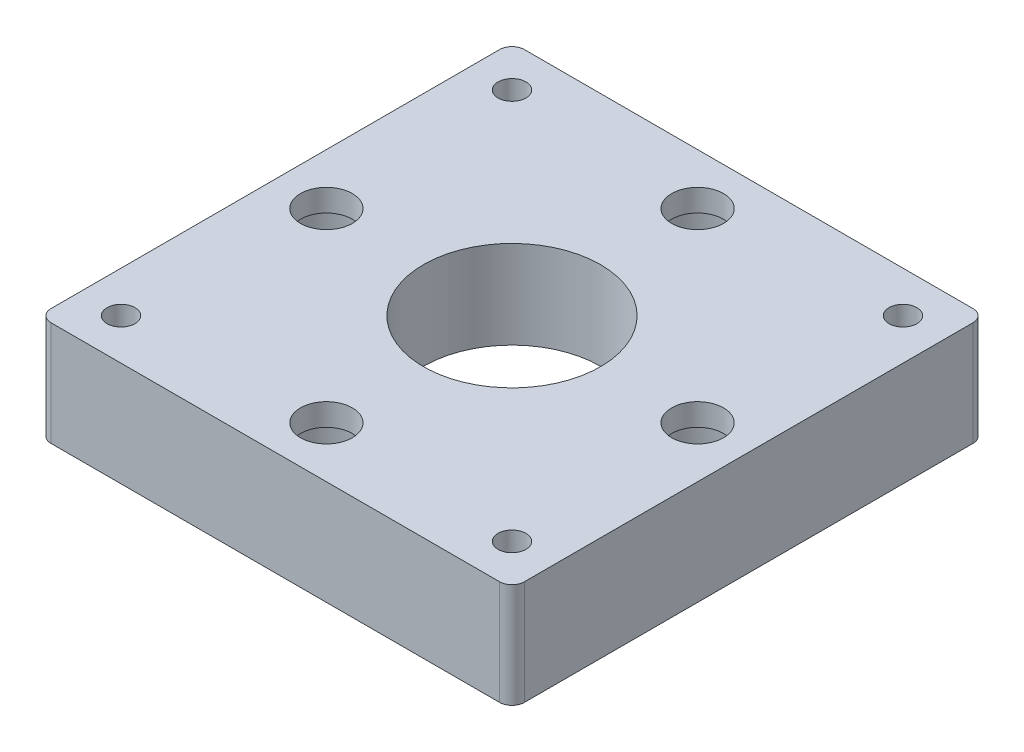
from build123d import *

# Parameters (mm, degrees)
SALIENTE_EXTRUIR1_DEPTH = 12.7
CROQUIS1_4_OUTSIDE_W    = 75.96
CROQUIS1_4_OUTSIDE_H    = 75.96
CROQUIS1_4_OUTSIDE_R    = 1.693796282
CORTAR_EXTRUIR1_DEPTH   = 29.7
CROQUIS2_R              = 19
CORTAR_EXTRUIR2_DEPTH   = 2
CROQUIS3_R              = 10.75
CORTAR_EXTRUIR3_DEPTH   = 43.043013688
CROQUIS4_R              = 5.5
CORTAR_EXTRUIR4_DEPTH   = 10
CROQUIS6_R              = 3.15
CORTAR_EXTRUIR5_DEPTH   = 42.870335561


with BuildPart() as part:
    # Croquis1 → Saliente-Extruir1 (new body)
    with BuildSketch(Plane(origin=(0, 0, 0), x_dir=(1, 0, 0), z_dir=(0, 1, 0))):
        with BuildLine():
            Line((-27.25, -28.75), (27.25, -28.75))
            ThreePointArc((27.25, -28.75), (28.310660172, -28.310660172), (28.75, -27.25))
            Line((28.75, -27.25), (28.75, 27.25))
            ThreePointArc((28.75, 27.25), (28.310660172, 28.310660172), (27.25, 28.75))
            Line((27.25, 28.75), (-27.25, 28.75))
            ThreePointArc((-27.25, 28.75), (-28.310660172, 28.310660172), (-28.75, 27.25))
            Line((-28.75, 27.25), (-28.75, -27.25))
            ThreePointArc((-28.75, -27.25), (-28.310660172, -28.310660172), (-27.25, -28.75))
        make_face()
    extrude(amount=SALIENTE_EXTRUIR1_DEPTH)

    # Croquis1<4> outside → Cortar-Extruir1 (cut)
    # profile 1 of 5: a face of its own
    with BuildSketch(Plane(origin=(0, 0, 0), x_dir=(1, 0, 0), z_dir=(0, 1, 0))):
        Rectangle(CROQUIS1_4_OUTSIDE_W, CROQUIS1_4_OUTSIDE_H)
        with BuildLine():
            Line((-27.25, -28.75), (27.25, -28.75))
            ThreePointArc((27.25, -28.75), (28.310660172, -28.310660172), (28.75, -27.25))
            Line((28.75, -27.25), (28.75, 27.25))
            ThreePointArc((28.75, 27.25), (28.310660172, 28.310660172), (27.25, 28.75))
            Line((27.25, 28.75), (-27.25, 28.75))
            ThreePointArc((-27.25, 28.75), (-28.310660172, 28.310660172), (-28.75, 27.25))
            Line((-28.75, 27.25), (-28.75, -27.25))
            ThreePointArc((-28.75, -27.25), (-28.310660172, -28.310660172), (-27.25, -28.75))
        make_face(mode=Mode.SUBTRACT)
    # profile 2 of 5: a face of its own
    with BuildSketch(Plane(origin=(0, 0, 0), x_dir=(1, 0, 0), z_dir=(0, 1, 0))):
        with Locations((-23.75, 23.75)):
            Circle(CROQUIS1_4_OUTSIDE_R)
    # profile 3 of 5: a face of its own
    with BuildSketch(Plane(origin=(0, 0, 0), x_dir=(1, 0, 0), z_dir=(0, 1, 0))):
        with Locations((23.75, 23.75)):
            Circle(CROQUIS1_4_OUTSIDE_R)
    # profile 4 of 5: a face of its own
    with BuildSketch(Plane(origin=(0, 0, 0), x_dir=(1, 0, 0), z_dir=(0, 1, 0))):
        with Locations((23.75, -23.75)):
            Circle(CROQUIS1_4_OUTSIDE_R)
    # profile 5 of 5: a face of its own
    with BuildSketch(Plane(origin=(0, 0, 0), x_dir=(1, 0, 0), z_dir=(0, 1, 0))):
        with Locations((-23.75, -23.75)):
            Circle(CROQUIS1_4_OUTSIDE_R)
    extrude(amount=CORTAR_EXTRUIR1_DEPTH, mode=Mode.SUBTRACT)

    # Croquis2 → Cortar-Extruir2 (cut)
    with BuildSketch(Plane.XZ):
        Circle(CROQUIS2_R)
    extrude(amount=-CORTAR_EXTRUIR2_DEPTH, mode=Mode.SUBTRACT)

    # Croquis3 → Cortar-Extruir3 (cut, through all)
    with BuildSketch(Plane.XZ.offset(-2)):
        Circle(CROQUIS3_R)
    extrude(amount=-CORTAR_EXTRUIR3_DEPTH, mode=Mode.SUBTRACT)

    # Croquis4 → Cortar-Extruir4 (cut)
    with BuildSketch(Plane.XZ):
        with Locations((22.55, 0)):
            Circle(CROQUIS4_R)
        with Locations((0, -22.55)):
            Circle(CROQUIS4_R)
        with Locations((-22.55, 0)):
            Circle(CROQUIS4_R)
        with Locations((0, 22.55)):
            Circle(CROQUIS4_R)
    extrude(amount=-CORTAR_EXTRUIR4_DEPTH, mode=Mode.SUBTRACT)

    # Croquis6 → Cortar-Extruir5 (cut, through all)
    with BuildSketch(Plane.XZ.offset(-10)):
        with Locations((22.55, 0)):
            Circle(CROQUIS6_R)
        with Locations((0, -22.55)):
            Circle(CROQUIS6_R)
        with Locations((-22.55, 0)):
            Circle(CROQUIS6_R)
        with Locations((0, 22.55)):
            Circle(CROQUIS6_R)
    extrude(amount=-CORTAR_EXTRUIR5_DEPTH, mode=Mode.SUBTRACT)


solid = part.part
